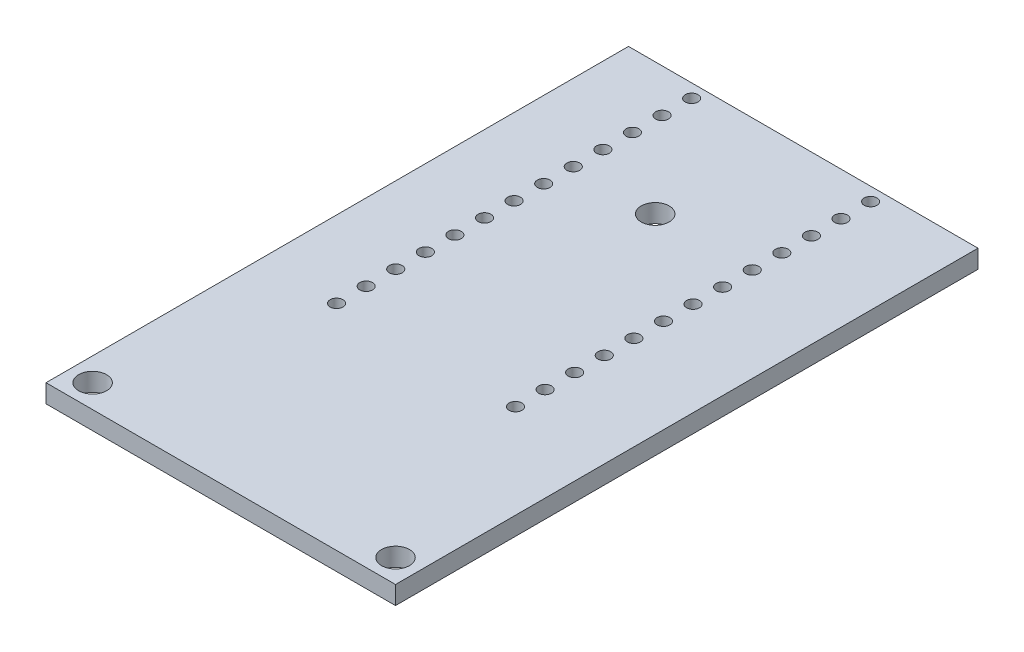
from build123d import *

# Parameters (mm, degrees)
SKETCH1_W            = 30
SKETCH1_H            = 70
BOSS_EXTRUDE1_DEPTH  = 1.57
M2_CLEARANCE_HOLE1_D = 2.4
CUT_EXTRUDE1_REACH   = 40.111
SKETCH6_R            = 0.55
LPATTERN1_COUNT      = 15
LPATTERN1_PITCH      = 2.54
SKETCH7_W            = 30
SKETCH7_H            = 20
CUT_EXTRUDE2_DEPTH   = 39.111217509
M2_CLEARANCE_HOLE2_D = 2.4


with BuildPart() as part:
    # Sketch1 → Boss-Extrude1 (new body)
    with BuildSketch(Plane(origin=(0, 0, 0), x_dir=(1, 0, 0), z_dir=(0, 1, 0))):
        Rectangle(SKETCH1_W, SKETCH1_H)
    extrude(amount=BOSS_EXTRUDE1_DEPTH)

    # M2 Clearance Hole1 (through all)
    with Locations(Plane(origin=(0, 1.57, 0), x_dir=(1, 0, 0), z_dir=(0, 1, 0))):
        with Locations((13, 33), (-13, 33), (-13, -33), (13, -33)):
            Hole(M2_CLEARANCE_HOLE1_D / 2)

    # Sketch6 → Cut-Extrude1 (cut, up to next)
    with BuildSketch(Plane(origin=(0, 1.57, 0), x_dir=(1, 0, 0), z_dir=(0, 1, 0)), mode=Mode.PRIVATE) as cut_extrude1_sk1:
        with Locations(Location((6.93, 18.93, 0), (0, 0, 270))):
            Circle(SKETCH6_R)
    cut_extrude1_tool1 = extrude(cut_extrude1_sk1.sketch, amount=-CUT_EXTRUDE1_REACH, mode=Mode.PRIVATE) & part.part
    # Sketch6 → Cut-Extrude1 (cut, up to next)
    with BuildSketch(Plane(origin=(0, 1.57, 0), x_dir=(1, 0, 0), z_dir=(0, 1, 0)), mode=Mode.PRIVATE) as cut_extrude1_sk2:
        with Locations(Location((-8.43, 18.93, 0), (0, 0, 270))):
            Circle(SKETCH6_R)
    cut_extrude1_tool2 = extrude(cut_extrude1_sk2.sketch, amount=-CUT_EXTRUDE1_REACH, mode=Mode.PRIVATE) & part.part
    cut_extrude1_1 = cut_extrude1_tool1.solids().sort_by_distance((6.93, 1.57, -18.93))[0]
    add(cut_extrude1_1, mode=Mode.SUBTRACT)
    cut_extrude1_2 = cut_extrude1_tool2.solids().sort_by_distance((-8.43, 1.57, -18.93))[0]
    add(cut_extrude1_2, mode=Mode.SUBTRACT)
    cut_extrude1 = cut_extrude1_1 + cut_extrude1_2  # Cut-Extrude1 as one shape, for the pattern or mirror that repeats it

    # LPattern1: Cut-Extrude1 ×15
    with Locations(*[(0, 0, i * LPATTERN1_PITCH) for i in range(1, LPATTERN1_COUNT)]):
        add(cut_extrude1, mode=Mode.SUBTRACT)

    # Sketch7 → Cut-Extrude2 (cut, through all)
    with BuildSketch(Plane.XZ):
        with Locations((0, -25)):
            Rectangle(SKETCH7_W, SKETCH7_H)
    extrude(amount=-CUT_EXTRUDE2_DEPTH, mode=Mode.SUBTRACT)

    # M2 Clearance Hole2 (through all)
    with Locations(Plane(origin=(0, 0, 0), x_dir=(-1, 0, 0), z_dir=(0, -1, 0))):
        with Locations((1.4, 3.69)):
            Hole(M2_CLEARANCE_HOLE2_D / 2)


solid = part.part
